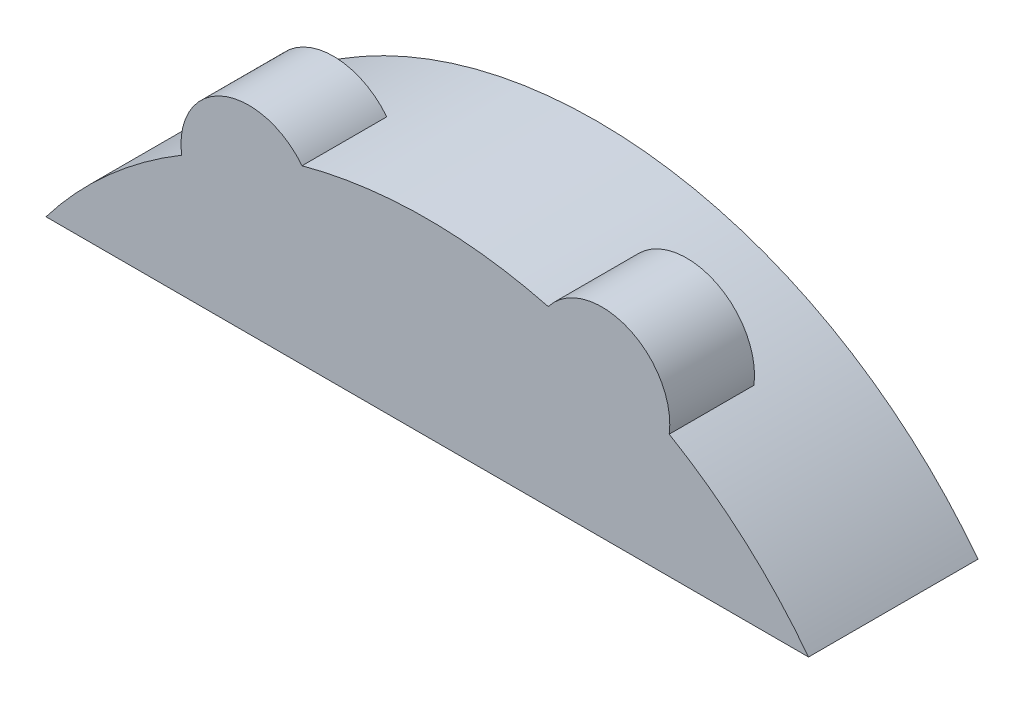
from build123d import *

# Parameters (mm, degrees)
BOSS_EXTRUDE2_DEPTH = 20
BOSS_EXTRUDE3_DEPTH = 10


with BuildPart() as part:
    # Sketch1 → Boss-Extrude2 (new body)
    with BuildSketch(Plane.XY):
        with BuildLine():
            Line((50, 35), (-40, 35))
            ThreePointArc((-40, 35), (5, 57.290269493), (50, 35))
        make_face()
    extrude(amount=-BOSS_EXTRUDE2_DEPTH)

    # Sketch3 → Boss-Extrude3 (add)
    with BuildSketch(Plane.XY):
        with BuildLine():
            Line((-23.995294076, 49.29407429), (-9.782013153, 55.324768004))
            ThreePointArc((-9.782013153, 55.324768004), (-19.193781446, 57.742200687), (-23.995294076, 49.29407429))
        make_face()
        with BuildLine():
            Line((19.274375244, 55.45966824), (33.55614581, 49.553545892))
            ThreePointArc((33.55614581, 49.553545892), (28.681224063, 57.986001061), (19.274375244, 55.45966824))
        make_face()
    extrude(amount=-BOSS_EXTRUDE3_DEPTH)


solid = part.part
